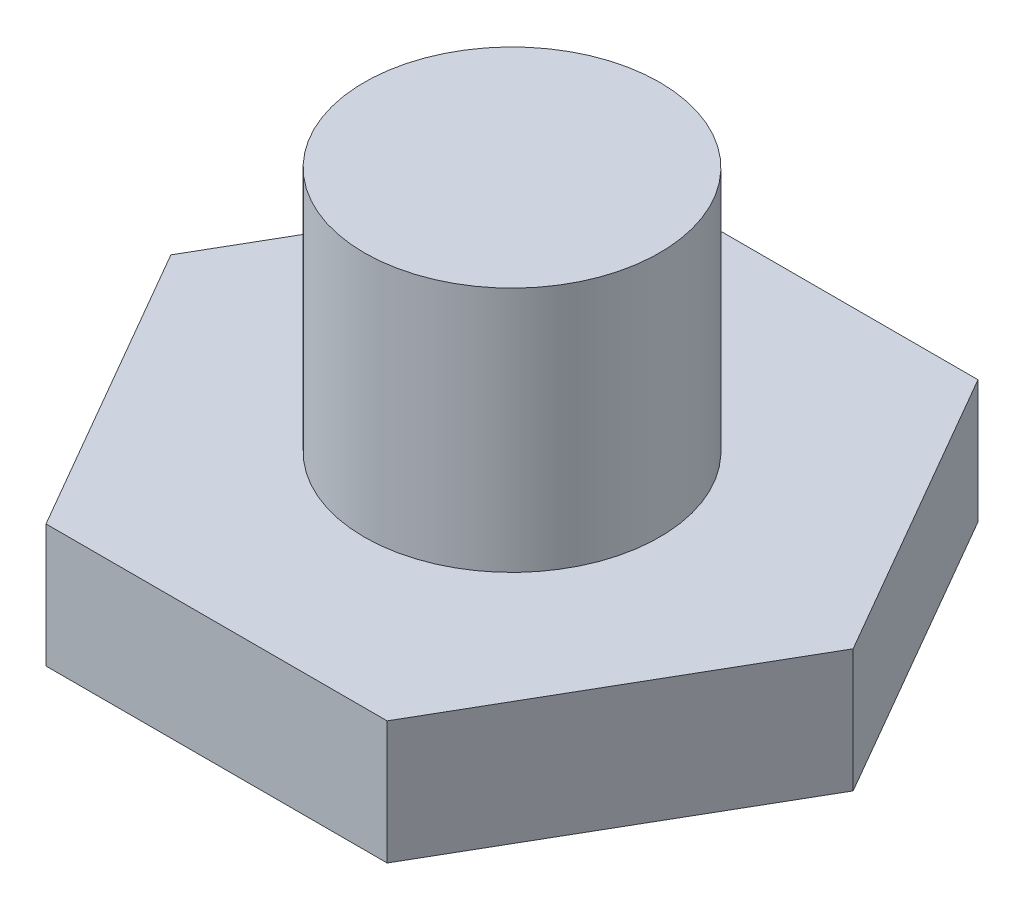
from build123d import *

# Parameters (mm, degrees)
EXTRUDE_1_DEPTH     = 15
SKETCH_2_OUTSIDE_W  = 37.634
SKETCH_2_OUTSIDE_H  = 33.922
SKETCH_2_OUTSIDE_R  = 6
CUT_EXTRUDE_1_DEPTH = 10


with BuildPart() as part:
    # Эскиз1 → Бобышка-Вытянуть1 (new body)
    with BuildSketch(Plane(origin=(0, 0, 0), x_dir=(1, 0, 0), z_dir=(0, 1, 0))):
        Polygon((13.856406461, 0), (6.92820323, 12), (-6.92820323, 12), (-13.856406461, 0), (-6.92820323, -12), (6.92820323, -12), align=None)
    extrude(amount=EXTRUDE_1_DEPTH)

    # Эскиз2 outside → Вырез-Вытянуть1 (cut)
    with BuildSketch(Plane(origin=(0, 15, 0), x_dir=(1, 0, 0), z_dir=(0, 1, 0))):
        Rectangle(SKETCH_2_OUTSIDE_W, SKETCH_2_OUTSIDE_H)
        with Locations(Location((0, 0, 0), (0, 0, 270))):
            Circle(SKETCH_2_OUTSIDE_R, mode=Mode.SUBTRACT)
    extrude(amount=-CUT_EXTRUDE_1_DEPTH, mode=Mode.SUBTRACT)


solid = part.part
